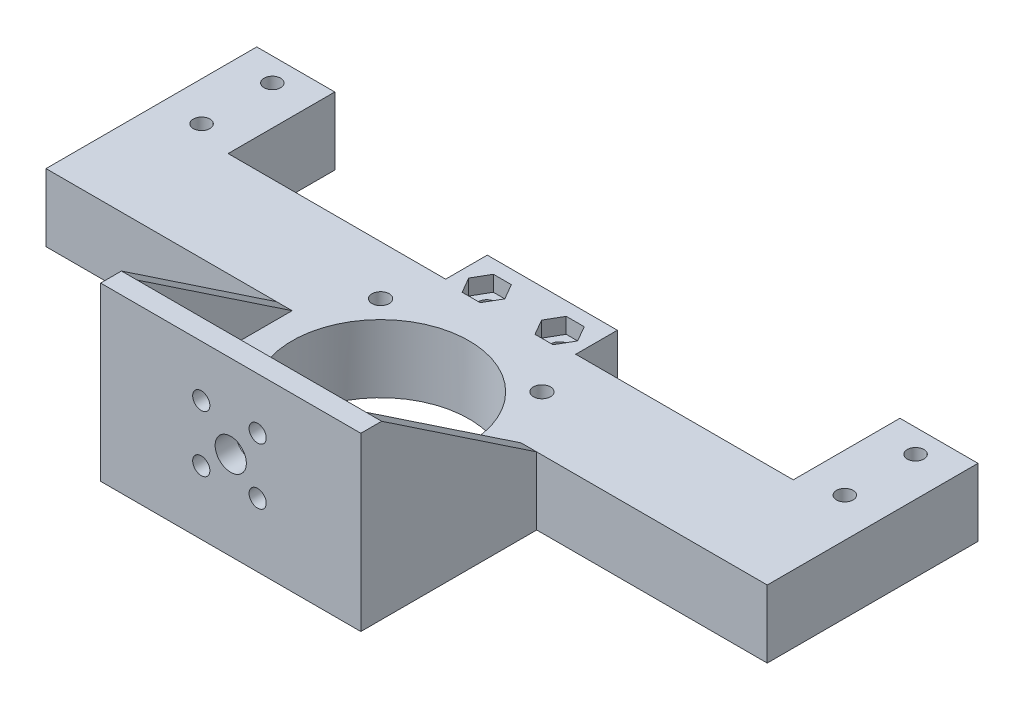
from build123d import *

# Parameters (mm, degrees)
SKETCH_2_R          = 1.6
SKETCH_2_R_2        = 17
SKETCH_2_R_3        = 1.65
EXTRUDE_2_DEPTH     = 13
CUT_EXTRUDE_1_DEPTH = 3
EXTRUDE_3_DEPTH     = 20
CUT_EXTRUDE_2_DEPTH = 125.506947597
SKETCH_8_W          = 24
SKETCH_8_H          = 20
CUT_EXTRUDE_3_DEPTH = 6
SKETCH_10_R         = 3
SKETCH_10_R_2       = 1.65
CUT_EXTRUDE_4_DEPTH = 5


with BuildPart() as part:
    # 草图2 → 凸台-拉伸2 (new body)
    with BuildSketch(Plane(origin=(0, 0, 0), x_dir=(1, 0, 0), z_dir=(0, 1, 0))):
        Polygon((-44.3, 33.8), (-44.3, 74.3), (-29.3, 74.3), (-29.3, 53.8), (12.5, 53.8), (12.5, 61.8), (37.5, 61.8), (37.5, 53.8), (79.3, 53.8), (79.3, 74.3), (94.3, 74.3), (94.3, 33.8), (50, 33.8), (50, 0), (0, 0), (0, 33.8), align=None)
        with Locations(Location((-36.8, 69.8, 0), (0, 0, 90))):
            Circle(SKETCH_2_R, mode=Mode.SUBTRACT)
        with Locations(Location((-36.8, 56.2, 0), (0, 0, 90))):
            Circle(SKETCH_2_R, mode=Mode.SUBTRACT)
        with Locations(Location((86.8, 69.8, 0), (0, 0, 90))):
            Circle(SKETCH_2_R, mode=Mode.SUBTRACT)
        with Locations(Location((86.8, 56.2, 0), (0, 0, 90))):
            Circle(SKETCH_2_R, mode=Mode.SUBTRACT)
        with Locations(Location((18, 56.2, 0), (0, 0, 90))):
            Circle(SKETCH_2_R, mode=Mode.SUBTRACT)
        with Locations(Location((32, 56.2, 0), (0, 0, 90))):
            Circle(SKETCH_2_R, mode=Mode.SUBTRACT)
        with Locations(Location((25, 28.8, 0), (0, 0, 90))):
            Circle(SKETCH_2_R_2, mode=Mode.SUBTRACT)
        with Locations(Location((40.5, 44.3, 0), (0, 0, 90))):
            Circle(SKETCH_2_R_3, mode=Mode.SUBTRACT)
        with Locations(Location((40.5, 13.3, 0), (0, 0, 90))):
            Circle(SKETCH_2_R_3, mode=Mode.SUBTRACT)
        with Locations(Location((9.5, 13.3, 0), (0, 0, 90))):
            Circle(SKETCH_2_R_3, mode=Mode.SUBTRACT)
        with Locations(Location((9.5, 44.3, 0), (0, 0, 90))):
            Circle(SKETCH_2_R_3, mode=Mode.SUBTRACT)
    extrude(amount=EXTRUDE_2_DEPTH)

    # 草图3 → 切除-拉伸1 (cut)
    with BuildSketch(Plane(origin=(0, 13, 0), x_dir=(1, 0, 0), z_dir=(0, 1, 0))):
        Polygon((21.464101615, 56.2), (19.732050808, 59.2), (16.267949192, 59.2), (14.535898385, 56.2), (16.267949192, 53.2), (19.732050808, 53.2), align=None)
        Polygon((35.464101615, 56.2), (33.732050808, 59.2), (30.267949192, 59.2), (28.535898385, 56.2), (30.267949192, 53.2), (33.732050808, 53.2), align=None)
    extrude(amount=-CUT_EXTRUDE_1_DEPTH, mode=Mode.SUBTRACT)

    # 草图6 → 凸台-拉伸3 (add)
    with BuildSketch(Plane(origin=(0, 13, 0), x_dir=(1, 0, 0), z_dir=(0, 1, 0))):
        Polygon((0, 33.8), (0, 0), (50, 0), (50, 33.8), (47, 33.8), (47, 4), (3, 4), (3, 33.8), align=None)
    extrude(amount=EXTRUDE_3_DEPTH)

    # 草图7 → 切除-拉伸2 (cut, through all)
    with BuildSketch(Plane.ZY):
        Polygon((-33.8, 13), (-4, 33), (-33.8, 33), align=None)
    extrude(amount=-CUT_EXTRUDE_2_DEPTH, mode=Mode.SUBTRACT)

    # 草图8 → 切除-拉伸3 (cut)
    with BuildSketch(Plane(origin=(0, 13, 0), x_dir=(1, 0, 0), z_dir=(0, 1, 0))):
        with Locations((25, 14)):
            Rectangle(SKETCH_8_W, SKETCH_8_H)
    extrude(amount=-CUT_EXTRUDE_3_DEPTH, mode=Mode.SUBTRACT)

    # 草图10 → 切除-拉伸4 (cut)
    with BuildSketch(Plane.XY):
        with Locations((25, 17)):
            Circle(SKETCH_10_R)
        with Locations((30.173451969, 23.102081179)):
            Circle(SKETCH_10_R_2)
        with Locations((30.173451969, 12.264714161)):
            Circle(SKETCH_10_R_2)
        with Locations((19.336084951, 12.264714161)):
            Circle(SKETCH_10_R_2)
        with Locations((19.336084951, 23.102081179)):
            Circle(SKETCH_10_R_2)
    extrude(amount=-CUT_EXTRUDE_4_DEPTH, mode=Mode.SUBTRACT)


solid = part.part
